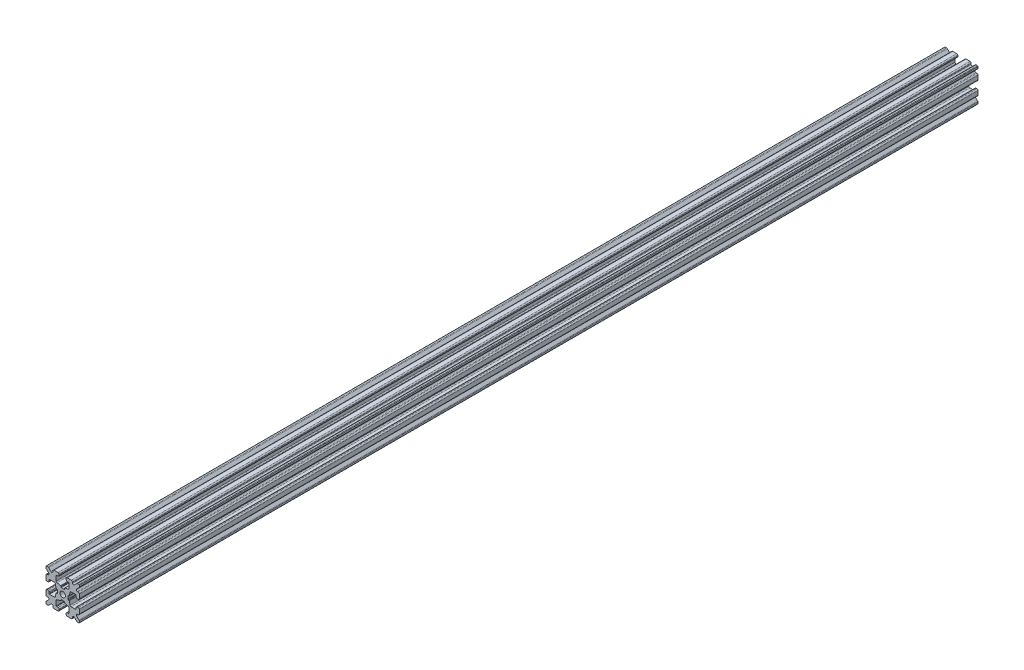
from build123d import *

# Parameters (mm, degrees)
SKETCH1_W           = 15
SKETCH1_H           = 15
SKETCH1_R           = 1.25
BOSS_EXTRUDE1_DEPTH = 202.5
FILLET1_R           = 0.25
CUT_EXTRUDE1_DEPTH  = 406.138865082
CUT_EXTRUDE3_DEPTH  = 406.138865082
FILLET3_R           = 0.5
FILLET4_R           = 0.5
FILLET5_R           = 3
FILLET6_R           = 0.2
CUT_EXTRUDE4_DEPTH  = 406.138865082
FILLET8_R           = 0.5
SKETCH6_W           = 5.1529354
SKETCH6_H           = 1.651
SKETCH6_W_2         = 1.651
SKETCH6_H_2         = 5.1529354
CUT_EXTRUDE5_DEPTH  = 406.138865082
FILLET10_R          = 0.2


with BuildPart() as part:
    # Sketch1 → Boss-Extrude1 (new, symmetric)
    with BuildSketch(Plane.XY):
        Rectangle(SKETCH1_W, SKETCH1_H)
        Circle(SKETCH1_R, mode=Mode.SUBTRACT)
    extrude(amount=BOSS_EXTRUDE1_DEPTH, both=True)

    # Fillet1
    fillet1_edges = [part.edges().sort_by_distance(p)[0] for p in [
        (7.5, -7.5, 0),
        (-7.5, -7.5, 0),
        (-7.5, 7.5, 0),
        (7.5, 7.5, 0),
    ]]
    fillet(fillet1_edges, radius=FILLET1_R)

    # Sketch2 → Cut-Extrude1 (cut, through all)
    with BuildSketch(Plane.XY.offset(202.5)):
        Polygon((-7.5, 1.6), (-6.1, 1.6), (-6.1, 2.9), (-3.4, 2.9), (-3.4, -2.9), (-6.1, -2.9), (-6.1, -1.6), (-7.5, -1.6), align=None)
        Polygon((2.9, 6.1), (1.6, 6.1), (1.6, 7.5), (-1.6, 7.5), (-1.6, 6.1), (-2.9, 6.1), (-2.9, 3.4), (2.9, 3.4), align=None)
        Polygon((-1.6, -7.5), (-1.6, -6.1), (-2.9, -6.1), (-2.9, -3.4), (2.9, -3.4), (2.9, -6.1), (1.6, -6.1), (1.6, -7.5), align=None)
        Polygon((6.1, -2.9), (6.1, -1.6), (7.5, -1.6), (7.5, 1.6), (6.1, 1.6), (6.1, 2.9), (3.4, 2.9), (3.4, -2.9), align=None)
    extrude(amount=-CUT_EXTRUDE1_DEPTH, mode=Mode.SUBTRACT)

    # Sketch4 → Cut-Extrude3 (cut, through all)
    with BuildSketch(Plane.XY.offset(202.5)):
        Polygon((-3.4, 2.9), (-2.75, 0), (-3.4, -2.9), align=None)
        Polygon((-2.9, 3.4), (0, 2.75), (2.9, 3.4), align=None)
        Polygon((3.4, 2.9), (2.75, 0), (3.4, -2.9), align=None)
        Polygon((-2.9, -3.4), (0, -2.75), (2.9, -3.4), align=None)
    extrude(amount=-CUT_EXTRUDE3_DEPTH, mode=Mode.SUBTRACT)

    # Fillet3
    fillet3_edges = [part.edges().sort_by_distance(p)[0] for p in [
        (1.6, -7.5, 0),
        (-1.6, -7.5, 0),
        (-1.6, -6.1, 0),
        (1.6, -6.1, 0),
        (6.1, 1.6, 0),
        (7.5, 1.6, 0),
        (7.5, -1.6, 0),
        (6.1, -1.6, 0),
        (-7.5, -1.6, 0),
        (-7.5, 1.6, 0),
        (-6.1, 1.6, 0),
        (-6.1, -1.6, 0),
        (-1.6, 6.1, 0),
        (-1.6, 7.5, 0),
        (1.6, 7.5, 0),
        (1.6, 6.1, 0),
    ]]
    fillet(fillet3_edges, radius=FILLET3_R)

    # Fillet4
    fillet4_edges = [part.edges().sort_by_distance(p)[0] for p in [
        (-2.9, -3.4, 0),
        (2.9, -3.4, 0),
        (3.4, -2.9, 0),
        (3.4, 2.9, 0),
        (-3.4, 2.9, 0),
        (-3.4, -2.9, 0),
        (2.9, 3.4, 0),
        (-2.9, 3.4, 0),
    ]]
    fillet(fillet4_edges, radius=FILLET4_R)

    # Fillet5
    fillet5_edges = [part.edges().sort_by_distance(p)[0] for p in [
        (-2.75, 0, 0),
        (0, 2.75, 0),
        (2.75, 0, 0),
        (0, -2.75, 0),
    ]]
    fillet(fillet5_edges, radius=FILLET5_R)

    # Fillet6
    fillet6_edges = [part.edges().sort_by_distance(p)[0] for p in [
        (-2.9, -6.1, 0),
        (2.9, -6.1, 0),
        (6.1, -2.9, 0),
        (6.1, 2.9, 0),
        (-6.1, 2.9, 0),
        (-6.1, -2.9, 0),
        (2.9, 6.1, 0),
        (-2.9, 6.1, 0),
    ]]
    fillet(fillet6_edges, radius=FILLET6_R)

    # Sketch5 → Cut-Extrude4 (cut, through all)
    with BuildSketch(Plane.XY.offset(202.5)):
        Polygon((-7.5, 6.439339828), (-5.460660172, 4.4), (-7.5, 4.4), align=None)
        Polygon((-6.439339828, 7.5), (-4.4, 5.460660172), (-4.4, 7.5), align=None)
        Polygon((4.4, 7.5), (6.439339828, 7.5), (4.4, 5.460660172), align=None)
        Polygon((7.5, 6.439339828), (7.5, 4.4), (5.460660172, 4.4), align=None)
        Polygon((7.5, -6.439339828), (5.460660172, -4.4), (7.5, -4.4), align=None)
        Polygon((6.439339828, -7.5), (4.4, -5.460660172), (4.4, -7.5), align=None)
        Polygon((-4.4, -7.5), (-6.439339828, -7.5), (-4.4, -5.460660172), align=None)
        Polygon((-7.5, -6.439339828), (-7.5, -4.4), (-5.460660172, -4.4), align=None)
    extrude(amount=-CUT_EXTRUDE4_DEPTH, mode=Mode.SUBTRACT)

    # Fillet8
    fillet8_edges = [part.edges().sort_by_distance(p)[0] for p in [
        (-7.5, 4.4, 0),
        (-7.5, 6.439339828, 0),
        (-5.460660172, 4.4, 0),
        (7.5, -4.4, 0),
        (7.5, -6.439339828, 0),
        (5.460660172, -4.4, 0),
        (5.460660172, 4.4, 0),
        (7.5, 6.439339828, 0),
        (7.5, 4.4, 0),
        (-4.4, 7.5, 0),
        (-4.4, 5.460660172, 0),
        (-6.439339828, 7.5, 0),
        (-5.460660172, -4.4, 0),
        (-7.5, -6.439339828, 0),
        (-7.5, -4.4, 0),
        (4.4, 5.460660172, 0),
        (4.4, 7.5, 0),
        (6.439339828, 7.5, 0),
        (6.439339828, -7.5, 0),
        (4.4, -7.5, 0),
        (4.4, -5.460660172, 0),
        (-6.439339828, -7.5, 0),
        (-4.4, -5.460660172, 0),
        (-4.4, -7.5, 0),
    ]]
    fillet(fillet8_edges, radius=FILLET8_R)

    # Sketch6 → Cut-Extrude5 (cut, through all)
    with BuildSketch(Plane.XY.offset(202.5)):
        with Locations((4.9235323, 0)):
            Rectangle(SKETCH6_W, SKETCH6_H)
        with Locations((0, -4.9235323)):
            Rectangle(SKETCH6_W_2, SKETCH6_H_2)
        with Locations((-4.9235323, 0)):
            Rectangle(SKETCH6_W, SKETCH6_H)
        with Locations((0, 4.9235323)):
            Rectangle(SKETCH6_W_2, SKETCH6_H_2)
    extrude(amount=-CUT_EXTRUDE5_DEPTH, mode=Mode.SUBTRACT)

    # Fillet10
    fillet10_edges = [part.edges().sort_by_distance(p)[0] for p in [
        (0.8255, -2.935025862, 0),
        (-0.8255, -2.935025862, 0),
        (0.8255, -2.3470646, 0),
        (-0.8255, -2.3470646, 0),
        (2.935025862, 0.8255, 0),
        (2.935025862, -0.8255, 0),
        (2.3470646, 0.8255, 0),
        (2.3470646, -0.8255, 0),
        (-2.935025862, -0.8255, 0),
        (-2.935025862, 0.8255, 0),
        (-2.3470646, -0.8255, 0),
        (-2.3470646, 0.8255, 0),
        (-0.8255, 2.935025862, 0),
        (0.8255, 2.935025862, 0),
        (-0.8255, 2.3470646, 0),
        (0.8255, 2.3470646, 0),
    ]]
    fillet(fillet10_edges, radius=FILLET10_R)


solid = part.part
